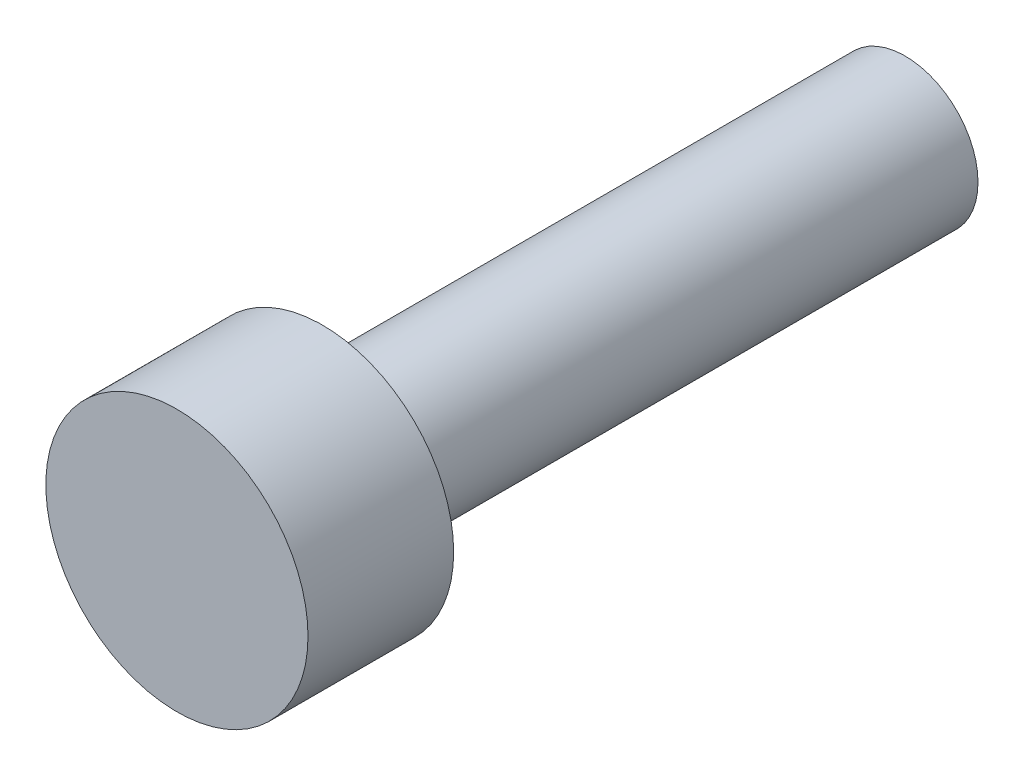
from build123d import *

# Parameters (mm, degrees)
SKETCH1_R                                = 2.25
ISO4762_M2P5_HEAD_ENVELOPE_DEPTH         = 2.5
M2P5X0P45X10_THREAD_MAJOR_ENVELOPE_START = -10
SKETCH2_R                                = 1.25
M2P5X0P45X10_THREAD_MAJOR_ENVELOPE_DEPTH = 10


with BuildPart() as part:
    # Sketch1 → ISO4762_M2p5_Head_Envelope (new body)
    with BuildSketch(Plane.XY):
        Circle(SKETCH1_R)
    extrude(amount=ISO4762_M2P5_HEAD_ENVELOPE_DEPTH)

    # Sketch2 → M2p5x0p45x10_Thread_Major_Envelope (add)
    with BuildSketch(Plane.XY.offset(M2P5X0P45X10_THREAD_MAJOR_ENVELOPE_START)):
        Circle(SKETCH2_R)
    extrude(amount=M2P5X0P45X10_THREAD_MAJOR_ENVELOPE_DEPTH)


solid = part.part
